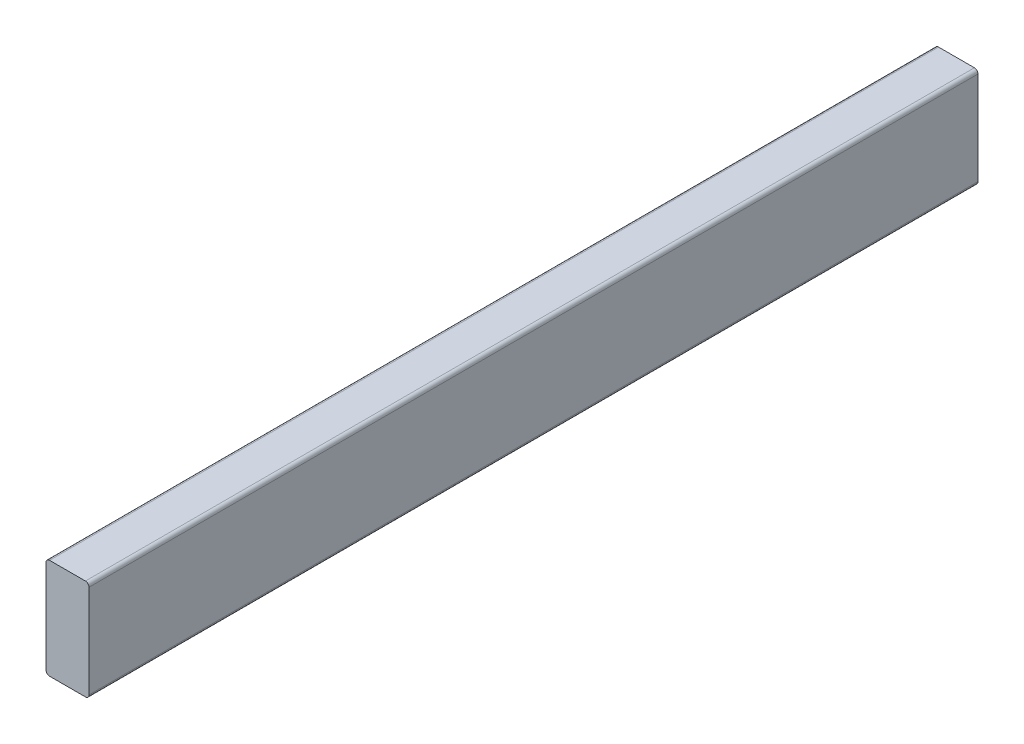
from build123d import *

# Parameters (mm, degrees)
SKETCH1_W           = 38.1
SKETCH1_H           = 88.9
BOSS_EXTRUDE1_DEPTH = 393.7
FILLET1_R           = 3.175


with BuildPart() as part:
    # Sketch1 → Boss-Extrude1 (new, symmetric)
    with BuildSketch(Plane.XY):
        with Locations((19.05, 44.45)):
            Rectangle(SKETCH1_W, SKETCH1_H)
    extrude(amount=BOSS_EXTRUDE1_DEPTH, both=True)

    # Fillet1
    fillet1_edges = [part.edges().sort_by_distance(p)[0] for p in [
        (0, 88.9, 0),
        (38.1, 88.9, 0),
        (38.1, 0, 0),
        (0, 0, 0),
    ]]
    fillet(fillet1_edges, radius=FILLET1_R)


solid = part.part
